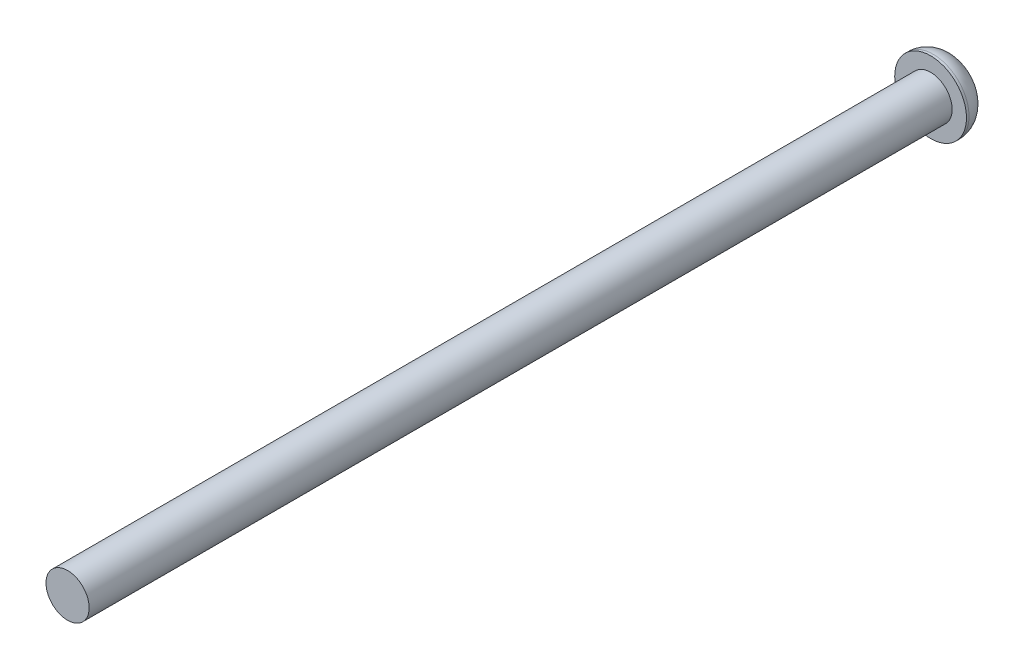
from build123d import *

# Parameters (mm, degrees)
SKETCH1_R           = 2.5
BOSS_EXTRUDE1_DEPTH = 100
SKETCH2_R           = 4.159584877
BOSS_EXTRUDE2_DEPTH = 2.8
FILLET1_R           = 2.5
CUT_EXTRUDE1_DEPTH  = 2


with BuildPart() as part:
    # Sketch1 → Boss-Extrude1 (new body)
    with BuildSketch(Plane.XY):
        Circle(SKETCH1_R)
    extrude(amount=BOSS_EXTRUDE1_DEPTH)

    # Sketch2 → Boss-Extrude2 (add)
    with BuildSketch(Plane(origin=(0, 0, 0), x_dir=(-1, 0, 0), z_dir=(0, 0, -1))):
        Circle(SKETCH2_R)
    extrude(amount=BOSS_EXTRUDE2_DEPTH)

    # Fillet1
    fillet1_edges = [part.edges().sort_by_distance(p)[0] for p in [
        (4.159584877, 0, -2.8),
    ]]
    fillet(fillet1_edges, radius=FILLET1_R)

    # Sketch3 → Cut-Extrude1 (cut)
    with BuildSketch(Plane(origin=(0, 0, -2.8), x_dir=(-1, 0, 0), z_dir=(0, 0, -1))):
        Polygon((1.392434699, -0.636521364), (1.247461021, 0.88762314), (-0.144973678, 1.524144504), (-1.392434699, 0.636521364), (-1.247461021, -0.88762314), (0.144973678, -1.524144504), align=None)
    extrude(amount=-CUT_EXTRUDE1_DEPTH, mode=Mode.SUBTRACT)


solid = part.part
